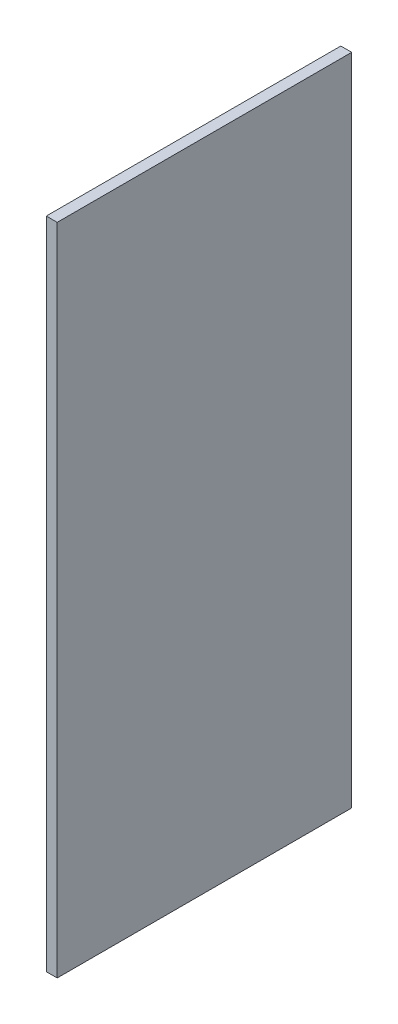
from build123d import *

# Parameters (mm, degrees)
SKETCH1_W           = 135
SKETCH1_H           = 300
BOSS_EXTRUDE1_DEPTH = 5


with BuildPart() as part:
    # Sketch1 → Boss-Extrude1 (new body)
    with BuildSketch(Plane(origin=(0, 0, 0), x_dir=(0, 0, -1), z_dir=(1, 0, 0))):
        Rectangle(SKETCH1_W, SKETCH1_H)
    extrude(amount=BOSS_EXTRUDE1_DEPTH)


solid = part.part
